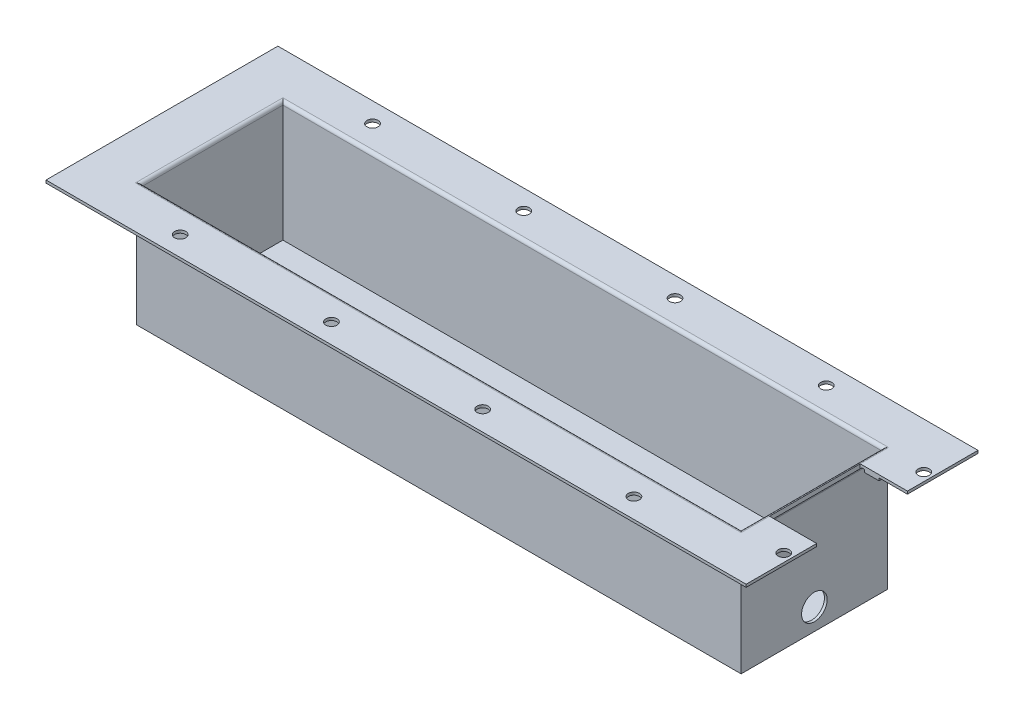
from build123d import *

# Parameters (mm, degrees)
SKETCH1_W               = 359.9
SKETCH1_H               = 87.2
BOSS_EXTRUDE1_DEPTH     = 1.6256
SKETCH2_W               = 359.9
SKETCH2_H               = 87.2
SKETCH2_W_2             = 356.6488
SKETCH2_H_2             = 83.9488
BOSS_EXTRUDE2_DEPTH     = 69.85
SKETCH3_W               = 416.6488
SKETCH3_H               = 138
SKETCH3_W_2             = 356.6488
SKETCH3_H_2             = 83.9488
BOSS_EXTRUDE3_DEPTH     = 1.6256
FILLET1_R               = 1.905
SKETCH6_W               = 371.0088
SKETCH6_H               = 92.8388
BOSS_EXTRUDE4_DEPTH     = 3.175
SKETCH8_R               = 7.62
CUT_EXTRUDE2_DEPTH      = 402.075797246
CUT_EXTRUDE4_DEPTH      = 232.308973187
CUT_EXTRUDE4_DEPTH_BACK = 232.308973187
SKETCH17_W              = 28.095
SKETCH17_H              = 54
CUT_EXTRUDE5_DEPTH      = 232.308973187
CUT_EXTRUDE5_DEPTH_BACK = 232.308973187
SKETCH18_R              = 3.325


with BuildPart() as part:
    # Sketch1 → Boss-Extrude1 (new body)
    with BuildSketch(Plane(origin=(0, 0, 0), x_dir=(1, 0, 0), z_dir=(0, 1, 0))):
        Rectangle(SKETCH1_W, SKETCH1_H)
    extrude(amount=BOSS_EXTRUDE1_DEPTH)

    # Sketch2 → Boss-Extrude2 (add)
    with BuildSketch(Plane(origin=(0, 1.6256, 0), x_dir=(1, 0, 0), z_dir=(0, 1, 0))):
        Rectangle(SKETCH2_W, SKETCH2_H)
        Rectangle(SKETCH2_W_2, SKETCH2_H_2, mode=Mode.SUBTRACT)
    extrude(amount=BOSS_EXTRUDE2_DEPTH)

    # Sketch3 → Boss-Extrude3 (add)
    with BuildSketch(Plane(origin=(0, 71.4756, 0), x_dir=(1, 0, 0), z_dir=(0, 1, 0))):
        Rectangle(SKETCH3_W, SKETCH3_H)
        Rectangle(SKETCH3_W_2, SKETCH3_H_2, mode=Mode.SUBTRACT)
    extrude(amount=BOSS_EXTRUDE3_DEPTH)

    # Fillet1
    fillet1_edges = [part.edges().sort_by_distance(p)[0] for p in [
        (0, 71.4756, -43.6),
        (-179.95, 71.4756, 0),
        (0, 71.4756, 43.6),
        (179.95, 71.4756, 0),
        (-178.3244, 73.1012, 0),
        (0, 73.1012, 41.9744),
        (178.3244, 73.1012, 0),
        (0, 73.1012, -41.9744),
    ]]
    fillet(fillet1_edges, radius=FILLET1_R)

    # Sketch6 → Boss-Extrude4 (add)
    with BuildSketch(Plane(origin=(0, 73.1012, 0), x_dir=(1, 0, 0), z_dir=(0, 1, 0))):
        Polygon((188.2394, -49.5944), (-188.2394, -49.5944), (-191.4144, -49.5944), (-191.4144, 49.5944), (-188.2394, 49.5944), (188.2394, 49.5944), (191.4144, 49.5944), (191.4144, -49.5944), align=None)
        with Locations((-2.735, 0)):
            Rectangle(SKETCH6_W, SKETCH6_H, mode=Mode.SUBTRACT)
    extrude(amount=-BOSS_EXTRUDE4_DEPTH)

    # Sketch8 → Cut-Extrude2 (cut, through all)
    with BuildSketch(Plane(origin=(179.95, 0, 0), x_dir=(0, 0, -1), z_dir=(1, 0, 0))):
        with Locations((0, 12.7)):
            Circle(SKETCH8_R)
    extrude(amount=-CUT_EXTRUDE2_DEPTH, mode=Mode.SUBTRACT)

    # Sketch17 → Cut-Extrude4 (cut, two sides: drawn at the far end of the back side and taken through both)
    with BuildSketch(Plane(origin=(0, 73.1012, 0), x_dir=(1, 0, 0), z_dir=(0, 1, 0)).offset(-CUT_EXTRUDE4_DEPTH_BACK)):
        with Locations((194.2769, 0)):
            Rectangle(SKETCH17_W, SKETCH17_H)
    extrude(amount=CUT_EXTRUDE4_DEPTH + CUT_EXTRUDE4_DEPTH_BACK, mode=Mode.SUBTRACT)

    # Sketch18 → Cut-Extrude5 (cut, two sides: drawn at the far end of the back side and taken through both)
    with BuildSketch(Plane(origin=(0, 73.1012, 0), x_dir=(1, 0, 0), z_dir=(0, 1, 0)).offset(-CUT_EXTRUDE5_DEPTH_BACK)):
        with Locations(Location((203.37295269, 41.64816795, 0), (0, 0, 270))):
            Circle(SKETCH18_R)
        with Locations(Location((203.37295269, -41.64816795, 0), (0, 0, 90))):
            Circle(SKETCH18_R)
        with Locations(Location((129.76878637, 57.22406113, 0), (0, 0, 270))):
            Circle(SKETCH18_R)
        with Locations(Location((-50.23121363, 57.22406113, 0), (0, 0, 270))):
            Circle(SKETCH18_R)
        with Locations(Location((39.76878637, 57.22406113, 0), (0, 0, 270))):
            Circle(SKETCH18_R)
        with Locations(Location((-140.23121363, 57.22406113, 0), (0, 0, 270))):
            Circle(SKETCH18_R)
        with Locations(Location((129.76878637, -57.22406113, 0), (0, 0, 90))):
            Circle(SKETCH18_R)
        with Locations(Location((39.76878637, -57.22406113, 0), (0, 0, 90))):
            Circle(SKETCH18_R)
        with Locations(Location((-50.23121363, -57.22406113, 0), (0, 0, 90))):
            Circle(SKETCH18_R)
        with Locations(Location((-140.23121363, -57.22406113, 0), (0, 0, 90))):
            Circle(SKETCH18_R)
    extrude(amount=CUT_EXTRUDE5_DEPTH + CUT_EXTRUDE5_DEPTH_BACK, mode=Mode.SUBTRACT)


solid = part.part
